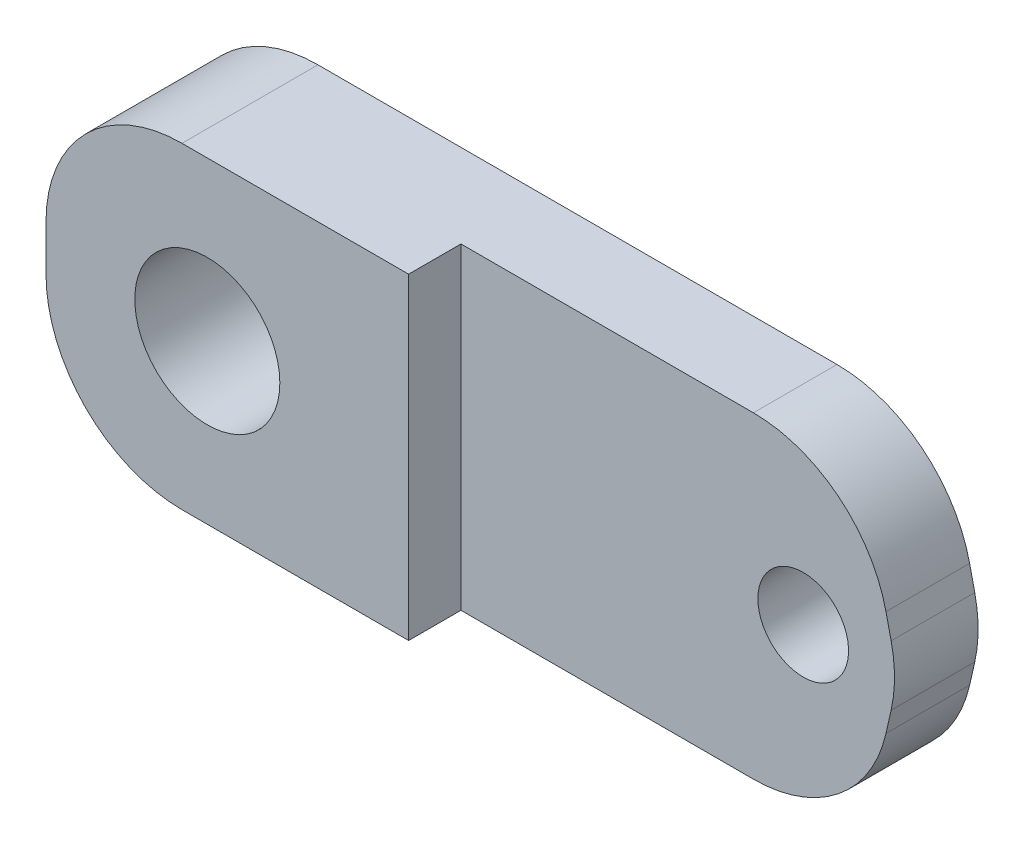
from build123d import *

# Parameters (mm, degrees)
IZIM1_R                     = 1.6
IZIM1_R_2                   = 1
Y_KSEKLIK_EKSTR_ZYON1_DEPTH = 3
IZIM2_W                     = 1.154616757
IZIM2_H                     = 7
KES_EKSTR_ZYON1_DEPTH       = 11.5


with BuildPart() as part:
    # Çizim1 → Yükseklik-Ekstrüzyon1 (new body)
    with BuildSketch(Plane.XY):
        with BuildLine():
            Line((-19.5, 0.5), (-19.5, -0.5))
            ThreePointArc((-19.5, -0.5), (-18.621320344, -2.621320344), (-16.5, -3.5))
            Line((-16.5, -3.5), (-5.048446869, -3.5))
            ThreePointArc((-5.048446869, -3.5), (-3.176019241, -2.843931479), (-2.122552163, -1.162676519))
            Line((-2.122552163, -1.162676519), (-2.009308765, -0.662676519))
            ThreePointArc((-2.009308765, -0.662676519), (-1.935203471, 0), (-2.009308765, 0.662676519))
            Line((-2.009308765, 0.662676519), (-2.122552163, 1.162676519))
            ThreePointArc((-2.122552163, 1.162676519), (-3.176019241, 2.843931479), (-5.048446869, 3.5))
            Line((-5.048446869, 3.5), (-16.5, 3.5))
            ThreePointArc((-16.5, 3.5), (-18.621320344, 2.621320344), (-19.5, 0.5))
        make_face()
        with Locations((-15.940902873, 0)):
            Circle(IZIM1_R, mode=Mode.SUBTRACT)
        with Locations((-3.94869662, 0)):
            Circle(IZIM1_R_2, mode=Mode.SUBTRACT)
    extrude(amount=Y_KSEKLIK_EKSTR_ZYON1_DEPTH)

    # Çizim2 → Kes-Ekstrüzyon1 (cut, symmetric)
    with BuildSketch(Plane(origin=(0, 0, 0), x_dir=(0, 0, -1), z_dir=(1, 0, 0))):
        with Locations((-2.422691622, 0)):
            Rectangle(IZIM2_W, IZIM2_H)
    extrude(amount=KES_EKSTR_ZYON1_DEPTH, both=True, mode=Mode.SUBTRACT)


solid = part.part
